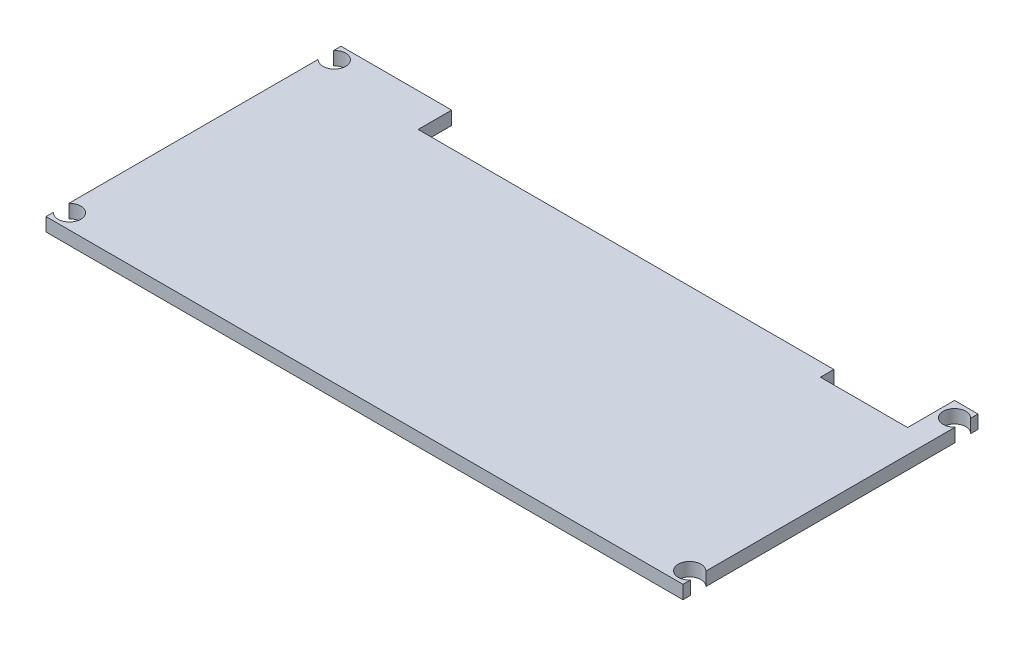
from build123d import *

# Parameters (mm, degrees)
SKETCH2_W           = 102
SKETCH2_H           = 50
BOSS_EXTRUDE2_DEPTH = 2
SKETCH1_W           = 98
SKETCH1_H           = 46
BOSS_EXTRUDE1_DEPTH = 2
FILLET1_R           = 2
SKETCH3_R           = 1
CUT_EXTRUDE1_DEPTH  = 1.6
CUT_EXTRUDE2_DEPTH  = 4
SKETCH5_OUTSIDE_W   = 126.722
SKETCH5_OUTSIDE_H   = 74.722
SKETCH5_OUTSIDE_W_2 = 95
SKETCH5_OUTSIDE_H_2 = 44
CUT_EXTRUDE3_DEPTH  = 10
SKETCH6_R           = 0.25
CUT_EXTRUDE4_DEPTH  = 10
SKETCH7_R           = 1.7
CUT_EXTRUDE5_DEPTH  = 10


with BuildPart() as part:
    # Sketch2 → Boss-Extrude2 (new body)
    with BuildSketch(Plane(origin=(0, 0, 0), x_dir=(1, 0, 0), z_dir=(0, 1, 0))):
        Rectangle(SKETCH2_W, SKETCH2_H)
    extrude(amount=BOSS_EXTRUDE2_DEPTH)

    # Sketch1 → Boss-Extrude1 (add)
    with BuildSketch(Plane(origin=(0, 0, 0), x_dir=(1, 0, 0), z_dir=(0, 1, 0))):
        Rectangle(SKETCH1_W, SKETCH1_H)
    extrude(amount=BOSS_EXTRUDE1_DEPTH)

    # Fillet1
    fillet1_edges = [part.edges().sort_by_distance(p)[0] for p in [
        (-51, 1, 25),
        (-51, 1, -25),
        (51, 1, -25),
        (51, 1, 25),
    ]]
    fillet(fillet1_edges, radius=FILLET1_R)

    # Sketch3 → Cut-Extrude1 (cut)
    with BuildSketch(Plane(origin=(0, 2, 0), x_dir=(1, 0, 0), z_dir=(0, 1, 0))):
        with Locations((-46.25, -19.75)):
            Circle(SKETCH3_R)
        with Locations((46.25, -19.75)):
            Circle(SKETCH3_R)
        with Locations((-46.25, 19.75)):
            Circle(SKETCH3_R)
        with Locations((46.25, 19.75)):
            Circle(SKETCH3_R)
    extrude(amount=-CUT_EXTRUDE1_DEPTH, mode=Mode.SUBTRACT)

    # Sketch4 → Cut-Extrude2 (cut)
    with BuildSketch(Plane(origin=(0, 2, 0), x_dir=(1, 0, 0), z_dir=(0, 1, 0))):
        Polygon((-31, 25), (-31, 21), (-31, 17), (-16, 17), (31, 17), (31, 15), (44, 15), (44, 19), (44, 25), align=None)
    extrude(amount=-CUT_EXTRUDE2_DEPTH, mode=Mode.SUBTRACT)

    # Sketch5 outside → Cut-Extrude3 (cut)
    with BuildSketch(Plane(origin=(0, 2, 0), x_dir=(1, 0, 0), z_dir=(0, 1, 0))):
        Rectangle(SKETCH5_OUTSIDE_W, SKETCH5_OUTSIDE_H)
        Rectangle(SKETCH5_OUTSIDE_W_2, SKETCH5_OUTSIDE_H_2, mode=Mode.SUBTRACT)
    extrude(amount=-CUT_EXTRUDE3_DEPTH, mode=Mode.SUBTRACT)

    # Sketch6 → Cut-Extrude4 (cut)
    with BuildSketch(Plane(origin=(0, 0.4, 0), x_dir=(1, 0, 0), z_dir=(0, 1, 0))):
        with Locations((-46.25, 19.75)):
            Circle(SKETCH6_R)
        with Locations((-46.25, -19.75)):
            Circle(SKETCH6_R)
        with Locations((46.25, 19.75)):
            Circle(SKETCH6_R)
        with Locations((46.25, -19.75)):
            Circle(SKETCH6_R)
    extrude(amount=-CUT_EXTRUDE4_DEPTH, mode=Mode.SUBTRACT)

    # Sketch7 → Cut-Extrude5 (cut)
    with BuildSketch(Plane(origin=(0, 2, 0), x_dir=(1, 0, 0), z_dir=(0, 1, 0))):
        with Locations((-46.25, -19.75)):
            Circle(SKETCH7_R)
        with Locations((-46.25, 19.75)):
            Circle(SKETCH7_R)
        with Locations((46.25, 19.75)):
            Circle(SKETCH7_R)
        with Locations((46.25, -19.75)):
            Circle(SKETCH7_R)
    extrude(amount=-CUT_EXTRUDE5_DEPTH, mode=Mode.SUBTRACT)


solid = part.part
